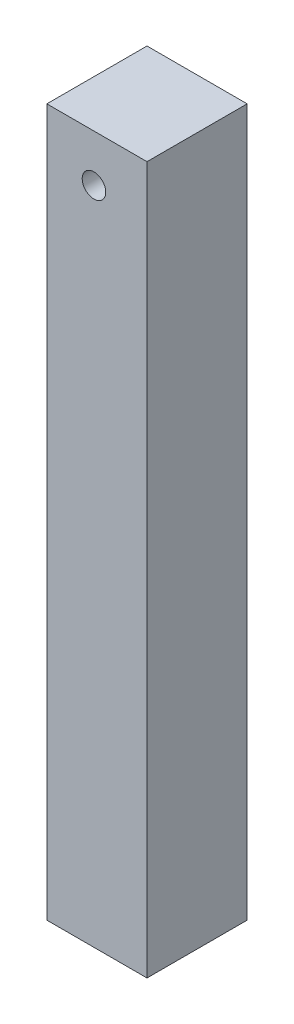
from build123d import *

# Parameters (mm, degrees)
SKETCH1_W           = 21.59
SKETCH1_H           = 21.59
BOSS_EXTRUDE1_DEPTH = 152.4
SKETCH2_R           = 2.54
CUT_EXTRUDE1_DEPTH  = 26.67


with BuildPart() as part:
    # Sketch1 → Boss-Extrude1 (new body)
    with BuildSketch(Plane(origin=(0, 0, 0), x_dir=(1, 0, 0), z_dir=(0, 1, 0))):
        with Locations((10.795, -10.795)):
            Rectangle(SKETCH1_W, SKETCH1_H)
    extrude(amount=BOSS_EXTRUDE1_DEPTH)

    # Sketch2 → Cut-Extrude1 (cut)
    with BuildSketch(Plane.XY):
        with Locations(Location((10.16, 142.24, 0), (0, 0, 180))):
            Circle(SKETCH2_R)
    extrude(amount=CUT_EXTRUDE1_DEPTH, mode=Mode.SUBTRACT)


solid = part.part
